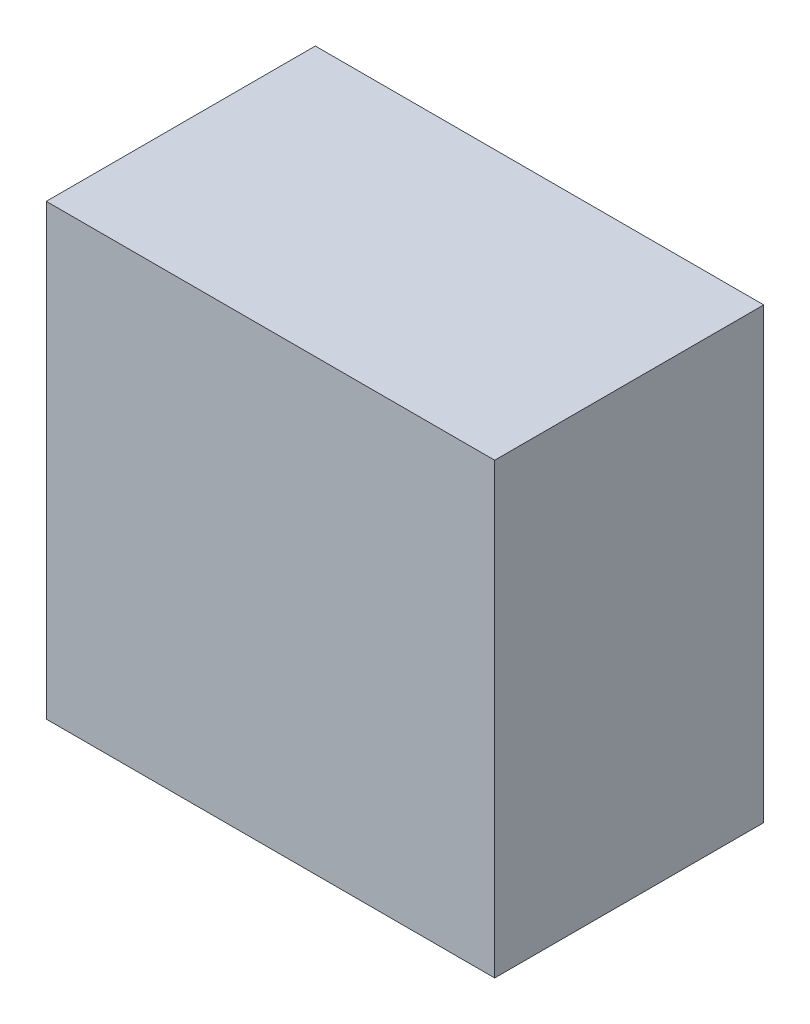
from build123d import *

# Parameters (mm, degrees)
SKETCH1_W           = 75
SKETCH1_H           = 75
BOSS_EXTRUDE1_DEPTH = 22.5


with BuildPart() as part:
    # Sketch1 → Boss-Extrude1 (new, symmetric)
    with BuildSketch(Plane.XY):
        Rectangle(SKETCH1_W, SKETCH1_H)
    extrude(amount=BOSS_EXTRUDE1_DEPTH, both=True)


solid = part.part
